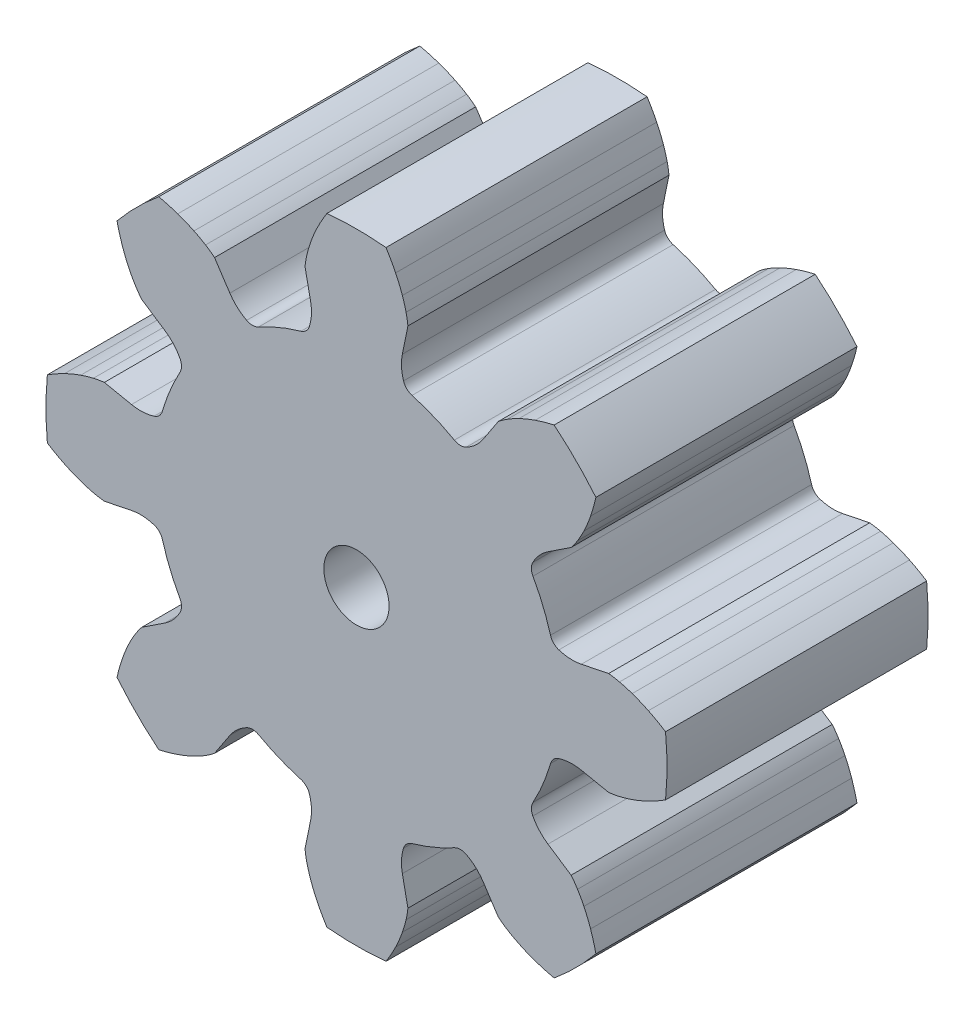
from build123d import *

# Parameters (mm, degrees)
BOSS_EXTRUDE1_DEPTH = 12.7
SKETCH2_R           = 1.5875
CUT_EXTRUDE1_DEPTH  = 25.850975796


with BuildPart() as part:
    # Model → Boss-Extrude1 (new body)
    with BuildSketch(Plane.XY):
        with BuildLine():
            Line((10.941748162, -2.232688974), (12.264436965, -2.502586677))
            ThreePointArc((12.264436965, -2.502586677), (12.531238017, -2.46596816), (12.795229484, -2.41274953))
            ThreePointArc((12.795229484, -2.41274953), (13.106430951, -2.331177744), (13.412940362, -2.233441923))
            ThreePointArc((13.412940362, -2.233441923), (13.811496383, -2.08104704), (14.200064035, -1.904734018))
            ThreePointArc((14.200064035, -1.904734018), (14.624278476, -1.682049743), (15.035831779, -1.436753888))
            ThreePointArc((15.035831779, -1.436753888), (15.104320541, 0), (15.035831779, 1.436753888))
            ThreePointArc((15.035831779, 1.436753888), (14.624278476, 1.682049743), (14.200064035, 1.904734018))
            ThreePointArc((14.200064035, 1.904734018), (13.811496383, 2.08104704), (13.412940362, 2.233441923))
            ThreePointArc((13.412940362, 2.233441923), (13.106430951, 2.331177744), (12.795229484, 2.41274953))
            ThreePointArc((12.795229484, 2.41274953), (12.531238017, 2.46596816), (12.264436965, 2.502586677))
            Line((12.264436965, 2.502586677), (10.941748216, 2.232688984))
            ThreePointArc((10.941748216, 2.232688984), (10.38941583, 2.191161038), (9.844221433, 2.288929667))
            ThreePointArc((9.844221433, 2.288929667), (9.58984879, 2.445145019), (9.439984515, 2.703310425))
            ThreePointArc((9.439984515, 2.703310425), (9.071969901, 3.757732961), (8.586606206, 4.763547917))
            ThreePointArc((8.586606206, 4.763547917), (8.510025734, 5.052068464), (8.579433412, 5.342398017))
            ThreePointArc((8.579433412, 5.342398017), (8.895811187, 5.797041528), (9.315733837, 6.15823481))
            Line((9.315733837, 6.15823481), (10.441862555, 6.902670535))
            ThreePointArc((10.441862555, 6.902670535), (10.604626186, 7.11722057), (10.753665089, 7.341521981))
            ThreePointArc((10.753665089, 7.341521981), (10.916037793, 7.619254612), (11.063663015, 7.905099156))
            ThreePointArc((11.063663015, 7.905099156), (11.237725225, 8.294680276), (11.387811912, 8.694111232))
            ThreePointArc((11.387811912, 8.694111232), (11.53031526, 9.1515377), (11.647877028, 9.616000194))
            ThreePointArc((11.647877028, 9.616000194), (10.68036748, 10.68036748), (9.616000194, 11.647877028))
            ThreePointArc((9.616000194, 11.647877028), (9.1515377, 11.53031526), (8.694111232, 11.387811912))
            ThreePointArc((8.694111232, 11.387811912), (8.294680276, 11.237725225), (7.905099156, 11.063663015))
            ThreePointArc((7.905099156, 11.063663015), (7.619254612, 10.916037793), (7.341521981, 10.753665089))
            ThreePointArc((7.341521981, 10.753665089), (7.11722057, 10.604626186), (6.902670535, 10.441862555))
            Line((6.902670535, 10.441862555), (6.15823484, 9.315733882))
            ThreePointArc((6.15823484, 9.315733882), (5.797041557, 8.895811214), (5.342398042, 8.57943342))
            ThreePointArc((5.342398042, 8.57943342), (5.052068486, 8.510025734), (4.763547932, 8.586606198))
            ThreePointArc((4.763547932, 8.586606198), (3.757732977, 9.071969895), (2.703310441, 9.43998451))
            ThreePointArc((2.703310441, 9.43998451), (2.445145035, 9.589848775), (2.288929678, 9.84422141))
            ThreePointArc((2.288929678, 9.84422141), (2.191161039, 10.38941579), (2.232688974, 10.941748162))
            Line((2.232688974, 10.941748162), (2.502586677, 12.264436965))
            ThreePointArc((2.502586677, 12.264436965), (2.46596816, 12.531238017), (2.41274953, 12.795229484))
            ThreePointArc((2.41274953, 12.795229484), (2.331177744, 13.106430951), (2.233441923, 13.412940362))
            ThreePointArc((2.233441923, 13.412940362), (2.08104704, 13.811496383), (1.904734018, 14.200064035))
            ThreePointArc((1.904734018, 14.200064035), (1.682049743, 14.624278476), (1.436753888, 15.035831779))
            ThreePointArc((1.436753888, 15.035831779), (0, 15.104320541), (-1.436753888, 15.035831779))
            ThreePointArc((-1.436753888, 15.035831779), (-1.682049743, 14.624278476), (-1.904734018, 14.200064035))
            ThreePointArc((-1.904734018, 14.200064035), (-2.08104704, 13.811496383), (-2.233441923, 13.412940362))
            ThreePointArc((-2.233441923, 13.412940362), (-2.331177744, 13.106430951), (-2.41274953, 12.795229484))
            ThreePointArc((-2.41274953, 12.795229484), (-2.46596816, 12.531238017), (-2.502586677, 12.264436965))
            Line((-2.502586677, 12.264436965), (-2.232688984, 10.941748216))
            ThreePointArc((-2.232688984, 10.941748216), (-2.191161038, 10.38941583), (-2.288929667, 9.844221433))
            ThreePointArc((-2.288929667, 9.844221433), (-2.445145019, 9.58984879), (-2.703310425, 9.439984515))
            ThreePointArc((-2.703310425, 9.439984515), (-3.757732961, 9.071969901), (-4.763547917, 8.586606206))
            ThreePointArc((-4.763547917, 8.586606206), (-5.052068464, 8.510025734), (-5.342398017, 8.579433412))
            ThreePointArc((-5.342398017, 8.579433412), (-5.797041528, 8.895811187), (-6.15823481, 9.315733837))
            Line((-6.15823481, 9.315733837), (-6.902670535, 10.441862555))
            ThreePointArc((-6.902670535, 10.441862555), (-7.11722057, 10.604626186), (-7.341521981, 10.753665089))
            ThreePointArc((-7.341521981, 10.753665089), (-7.619254612, 10.916037793), (-7.905099156, 11.063663015))
            ThreePointArc((-7.905099156, 11.063663015), (-8.294680276, 11.237725225), (-8.694111232, 11.387811912))
            ThreePointArc((-8.694111232, 11.387811912), (-9.1515377, 11.53031526), (-9.616000194, 11.647877028))
            ThreePointArc((-9.616000194, 11.647877028), (-10.68036748, 10.68036748), (-11.647877028, 9.616000194))
            ThreePointArc((-11.647877028, 9.616000194), (-11.53031526, 9.1515377), (-11.387811912, 8.694111232))
            ThreePointArc((-11.387811912, 8.694111232), (-11.237725225, 8.294680276), (-11.063663015, 7.905099156))
            ThreePointArc((-11.063663015, 7.905099156), (-10.916037793, 7.619254612), (-10.753665089, 7.341521981))
            ThreePointArc((-10.753665089, 7.341521981), (-10.604626186, 7.11722057), (-10.441862555, 6.902670535))
            Line((-10.441862555, 6.902670535), (-9.315733882, 6.15823484))
            ThreePointArc((-9.315733882, 6.15823484), (-8.895811214, 5.797041557), (-8.57943342, 5.342398042))
            ThreePointArc((-8.57943342, 5.342398042), (-8.510025734, 5.052068486), (-8.586606198, 4.763547932))
            ThreePointArc((-8.586606198, 4.763547932), (-9.071969895, 3.757732977), (-9.43998451, 2.703310441))
            ThreePointArc((-9.43998451, 2.703310441), (-9.589848775, 2.445145035), (-9.84422141, 2.288929678))
            ThreePointArc((-9.84422141, 2.288929678), (-10.38941579, 2.191161039), (-10.941748162, 2.232688974))
            Line((-10.941748162, 2.232688974), (-12.264436965, 2.502586677))
            ThreePointArc((-12.264436965, 2.502586677), (-12.531238017, 2.46596816), (-12.795229484, 2.41274953))
            ThreePointArc((-12.795229484, 2.41274953), (-13.106430951, 2.331177744), (-13.412940362, 2.233441923))
            ThreePointArc((-13.412940362, 2.233441923), (-13.811496383, 2.08104704), (-14.200064035, 1.904734018))
            ThreePointArc((-14.200064035, 1.904734018), (-14.624278476, 1.682049743), (-15.035831779, 1.436753888))
            ThreePointArc((-15.035831779, 1.436753888), (-15.104320541, 0), (-15.035831779, -1.436753888))
            ThreePointArc((-15.035831779, -1.436753888), (-14.624278476, -1.682049743), (-14.200064035, -1.904734018))
            ThreePointArc((-14.200064035, -1.904734018), (-13.811496383, -2.08104704), (-13.412940362, -2.233441923))
            ThreePointArc((-13.412940362, -2.233441923), (-13.106430951, -2.331177744), (-12.795229484, -2.41274953))
            ThreePointArc((-12.795229484, -2.41274953), (-12.531238017, -2.46596816), (-12.264436965, -2.502586677))
            Line((-12.264436965, -2.502586677), (-10.941748216, -2.232688984))
            ThreePointArc((-10.941748216, -2.232688984), (-10.38941583, -2.191161038), (-9.844221433, -2.288929667))
            ThreePointArc((-9.844221433, -2.288929667), (-9.58984879, -2.445145019), (-9.439984515, -2.703310425))
            ThreePointArc((-9.439984515, -2.703310425), (-9.071969901, -3.757732961), (-8.586606206, -4.763547917))
            ThreePointArc((-8.586606206, -4.763547917), (-8.510025734, -5.052068464), (-8.579433412, -5.342398017))
            ThreePointArc((-8.579433412, -5.342398017), (-8.895811187, -5.797041528), (-9.315733837, -6.15823481))
            Line((-9.315733837, -6.15823481), (-10.441862555, -6.902670535))
            ThreePointArc((-10.441862555, -6.902670535), (-10.604626186, -7.11722057), (-10.753665089, -7.341521981))
            ThreePointArc((-10.753665089, -7.341521981), (-10.916037793, -7.619254612), (-11.063663015, -7.905099156))
            ThreePointArc((-11.063663015, -7.905099156), (-11.237725225, -8.294680276), (-11.387811912, -8.694111232))
            ThreePointArc((-11.387811912, -8.694111232), (-11.53031526, -9.1515377), (-11.647877028, -9.616000194))
            ThreePointArc((-11.647877028, -9.616000194), (-10.68036748, -10.68036748), (-9.616000194, -11.647877028))
            ThreePointArc((-9.616000194, -11.647877028), (-9.1515377, -11.53031526), (-8.694111232, -11.387811912))
            ThreePointArc((-8.694111232, -11.387811912), (-8.294680276, -11.237725225), (-7.905099156, -11.063663015))
            ThreePointArc((-7.905099156, -11.063663015), (-7.619254612, -10.916037793), (-7.341521981, -10.753665089))
            ThreePointArc((-7.341521981, -10.753665089), (-7.11722057, -10.604626186), (-6.902670535, -10.441862555))
            Line((-6.902670535, -10.441862555), (-6.15823484, -9.315733882))
            ThreePointArc((-6.15823484, -9.315733882), (-5.797041557, -8.895811214), (-5.342398042, -8.57943342))
            ThreePointArc((-5.342398042, -8.57943342), (-5.052068486, -8.510025734), (-4.763547932, -8.586606198))
            ThreePointArc((-4.763547932, -8.586606198), (-3.757732977, -9.071969895), (-2.703310441, -9.43998451))
            ThreePointArc((-2.703310441, -9.43998451), (-2.445145035, -9.589848775), (-2.288929678, -9.84422141))
            ThreePointArc((-2.288929678, -9.84422141), (-2.191161039, -10.38941579), (-2.232688974, -10.941748162))
            Line((-2.232688974, -10.941748162), (-2.502586677, -12.264436965))
            ThreePointArc((-2.502586677, -12.264436965), (-2.46596816, -12.531238017), (-2.41274953, -12.795229484))
            ThreePointArc((-2.41274953, -12.795229484), (-2.331177744, -13.106430951), (-2.233441923, -13.412940362))
            ThreePointArc((-2.233441923, -13.412940362), (-2.08104704, -13.811496383), (-1.904734018, -14.200064035))
            ThreePointArc((-1.904734018, -14.200064035), (-1.682049743, -14.624278476), (-1.436753888, -15.035831779))
            ThreePointArc((-1.436753888, -15.035831779), (0, -15.104320541), (1.436753888, -15.035831779))
            ThreePointArc((1.436753888, -15.035831779), (1.682049743, -14.624278476), (1.904734018, -14.200064035))
            ThreePointArc((1.904734018, -14.200064035), (2.08104704, -13.811496383), (2.233441923, -13.412940362))
            ThreePointArc((2.233441923, -13.412940362), (2.331177744, -13.106430951), (2.41274953, -12.795229484))
            ThreePointArc((2.41274953, -12.795229484), (2.46596816, -12.531238017), (2.502586677, -12.264436965))
            Line((2.502586677, -12.264436965), (2.232688984, -10.941748216))
            ThreePointArc((2.232688984, -10.941748216), (2.191161038, -10.38941583), (2.288929667, -9.844221433))
            ThreePointArc((2.288929667, -9.844221433), (2.445145019, -9.58984879), (2.703310425, -9.439984515))
            ThreePointArc((2.703310425, -9.439984515), (3.757732961, -9.071969901), (4.763547917, -8.586606206))
            ThreePointArc((4.763547917, -8.586606206), (5.052068464, -8.510025734), (5.342398017, -8.579433412))
            ThreePointArc((5.342398017, -8.579433412), (5.797041528, -8.895811187), (6.15823481, -9.315733837))
            Line((6.15823481, -9.315733837), (6.902670535, -10.441862555))
            ThreePointArc((6.902670535, -10.441862555), (7.11722057, -10.604626186), (7.341521981, -10.753665089))
            ThreePointArc((7.341521981, -10.753665089), (7.619254612, -10.916037793), (7.905099156, -11.063663015))
            ThreePointArc((7.905099156, -11.063663015), (8.294680276, -11.237725225), (8.694111232, -11.387811912))
            ThreePointArc((8.694111232, -11.387811912), (9.1515377, -11.53031526), (9.616000194, -11.647877028))
            ThreePointArc((9.616000194, -11.647877028), (10.68036748, -10.68036748), (11.647877028, -9.616000194))
            ThreePointArc((11.647877028, -9.616000194), (11.53031526, -9.1515377), (11.387811912, -8.694111232))
            ThreePointArc((11.387811912, -8.694111232), (11.237725225, -8.294680276), (11.063663015, -7.905099156))
            ThreePointArc((11.063663015, -7.905099156), (10.916037793, -7.619254612), (10.753665089, -7.341521981))
            ThreePointArc((10.753665089, -7.341521981), (10.604626186, -7.11722057), (10.441862555, -6.902670535))
            Line((10.441862555, -6.902670535), (9.315733882, -6.15823484))
            ThreePointArc((9.315733882, -6.15823484), (8.895811214, -5.797041557), (8.57943342, -5.342398042))
            ThreePointArc((8.57943342, -5.342398042), (8.510025734, -5.052068486), (8.586606198, -4.763547932))
            ThreePointArc((8.586606198, -4.763547932), (8.843599005, -4.267546312), (9.071969898, -3.757732969))
            ThreePointArc((9.071969898, -3.757732969), (9.270979761, -3.235757898), (9.43998451, -2.703310441))
            ThreePointArc((9.43998451, -2.703310441), (9.589848775, -2.445145035), (9.84422141, -2.288929678))
            ThreePointArc((9.84422141, -2.288929678), (10.38941579, -2.191161039), (10.941748162, -2.232688974))
        make_face()
    extrude(amount=BOSS_EXTRUDE1_DEPTH)

    # Sketch2 → Cut-Extrude1 (cut, through all)
    with BuildSketch(Plane.XY.offset(12.7)):
        Circle(SKETCH2_R)
    extrude(amount=-CUT_EXTRUDE1_DEPTH, mode=Mode.SUBTRACT)


solid = part.part
